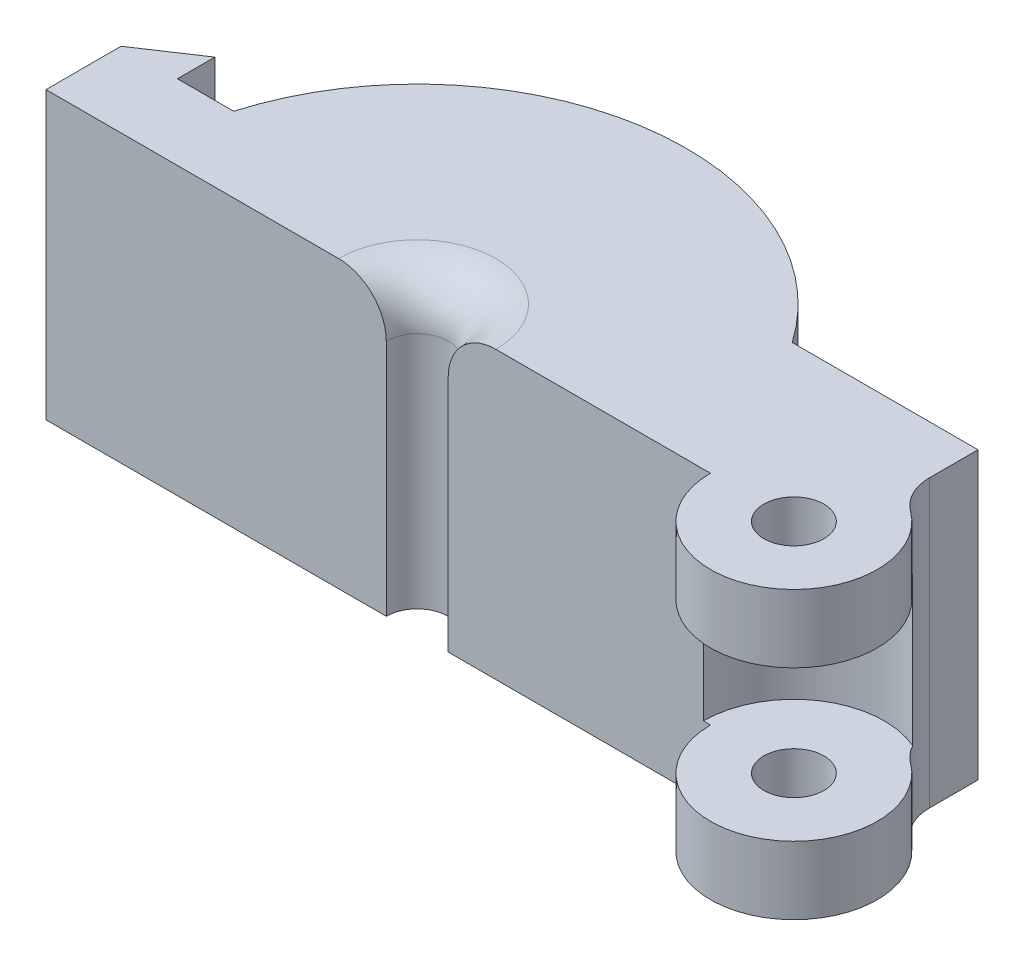
from build123d import *

# Parameters (mm, degrees)
SKETCH1_R           = 1.6000000000000016
BOSS_EXTRUDE1_DEPTH = 15.239999999999998
SKETCH2_R           = 4.8260000000000005
CUT_EXTRUDE1_DEPTH  = 4.0005
FILLET2_R           = 2.54
FILLET3_R           = 2.54


with BuildPart() as part:
    # Sketch1 → Boss-Extrude1 (new body)
    with BuildSketch(Plane(origin=(0, 0, 0), x_dir=(1, 0, 0), z_dir=(0, 1, 0))):
        with BuildLine():
            Line((-19.782278512640783, -6.1e-16), (-13.782278512640788, 0))
            Line((-13.782278512640788, 0), (-1.6509999999999998, 0))
            ThreePointArc((-1.651, -4.2e-16), (-3.8e-16, 1.6509999999999998), (1.6509999999999996, 0))
            Line((1.6509999999999998, 0), (15.624999999999998, -1.4e-16))
            ThreePointArc((15.625, -1.4e-16), (22.584560100693558, -3.665380266766327), (21.670000000000005, 4.147050156436503))
            Line((21.67, 4.147050156436504), (21.67, 8.211050156436503))
            Line((21.67, 8.211050156436503), (11.769870701434405, 8.211050156436503))
            ThreePointArc((11.769870701434405, 8.211050156436505), (6.637560553583663, 12.723756949011177), (2.2e-16, 14.351))
            ThreePointArc((8.9e-16, 14.350999999999999), (-8.618213300911037, 11.475086078108522), (-13.782278512640787, 4.000000000000001))
            Line((-13.782278512640788, 4), (-16.782278512640787, 4))
            Line((-16.782278512640787, 4), (-16.782278512640787, 6))
            Line((-16.782278512640787, 6), (-19.782278512640783, 4))
            Line((-19.782278512640783, 4), (-19.782278512640783, -6.1e-16))
        make_face()
        with Locations(Location((20.07, 8e-16, 0), (0, 0, 90))):
            Circle(SKETCH1_R, mode=Mode.SUBTRACT)
    extrude(amount=BOSS_EXTRUDE1_DEPTH)

    # Sketch2 → Cut-Extrude1 (cut, symmetric)
    with BuildSketch(Plane(origin=(0, 7.619999999999999, 0), x_dir=(1, 0, 0), z_dir=(0, 1, 0))):
        with Locations((20.07, 8e-16)):
            Circle(SKETCH2_R)
    extrude(amount=CUT_EXTRUDE1_DEPTH, both=True, mode=Mode.SUBTRACT)

    # Fillet2
    fillet2_edges = [part.edges().sort_by_distance(p)[0] for p in [
        (-3.8e-16, 15.239999999999998, -1.6509999999999998),
    ]]
    fillet(fillet2_edges, radius=FILLET2_R)

    # Fillet3
    fillet3_edges = [part.edges().sort_by_distance(p)[0] for p in [
        (21.67, 1.8097499999999997, -4.147050156436503),
    ]]
    fillet(fillet3_edges, radius=FILLET3_R)


solid = part.part
